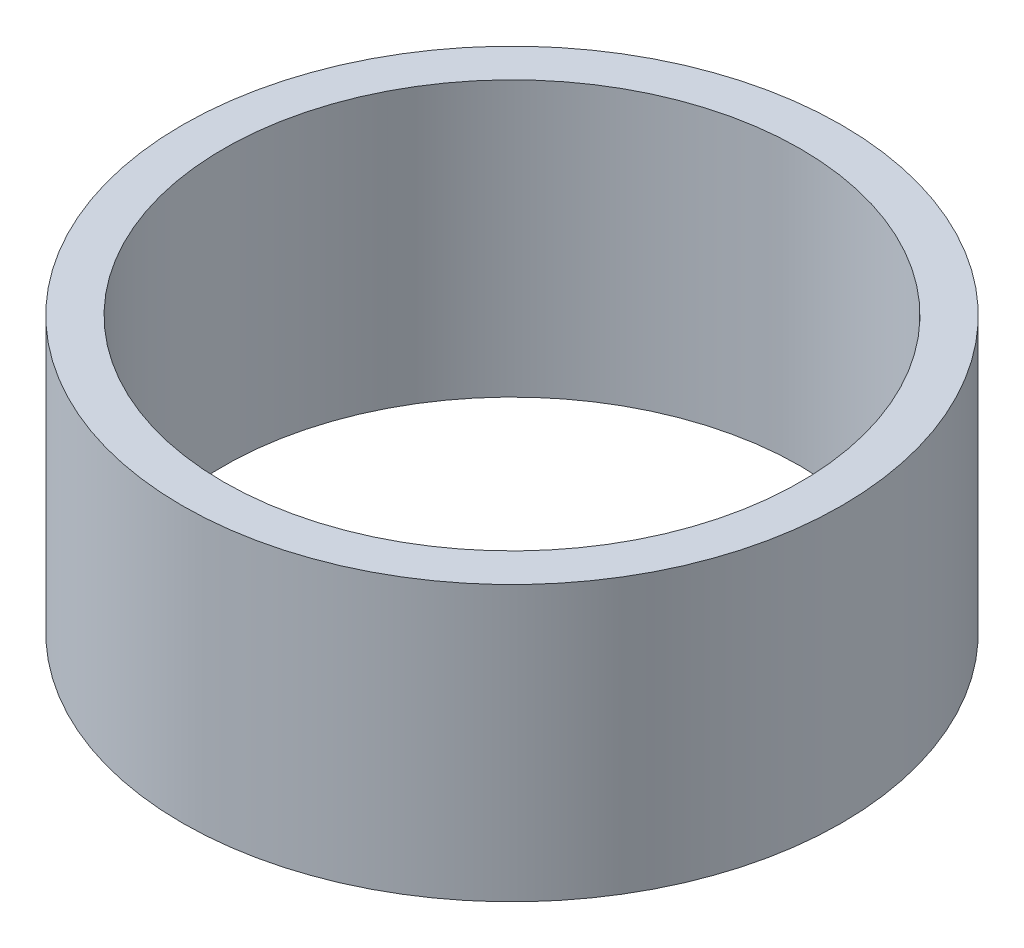
from build123d import *

# Parameters (mm, degrees)
SKETCH_1_R      = 6
SKETCH_1_R_2    = 5.25
EXTRUDE_1_DEPTH = 5


with BuildPart() as part:
    # 草图1 → 凸台-拉伸1 (new body)
    with BuildSketch(Plane(origin=(0, 0, 0), x_dir=(1, 0, 0), z_dir=(0, 1, 0))):
        with Locations(Location((0, 0, 0), (0, 0, 270))):
            Circle(SKETCH_1_R)
        with Locations(Location((0, 0, 0), (0, 0, 270))):
            Circle(SKETCH_1_R_2, mode=Mode.SUBTRACT)
    extrude(amount=EXTRUDE_1_DEPTH)


solid = part.part
